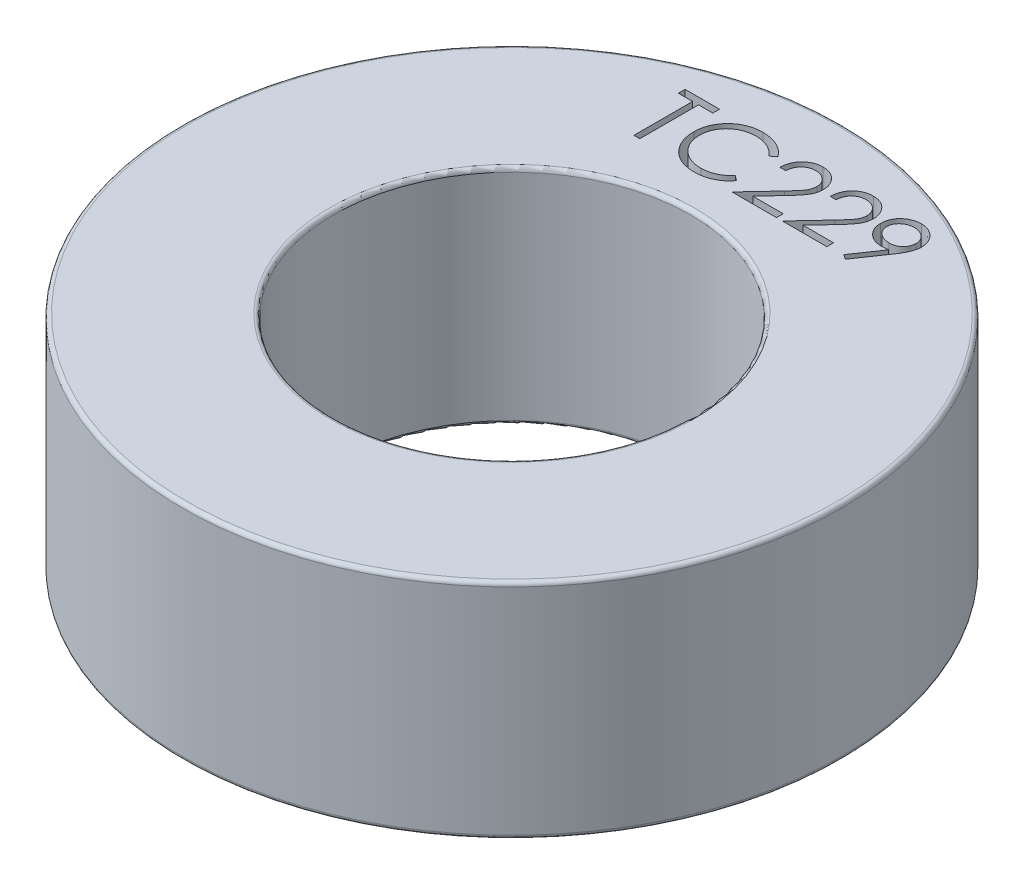
from build123d import *

# Parameters (mm, degrees)
CUT_EXTRUDE1_DEPTH = 1


with BuildPart() as part:
    # Toroidal Core TC229 → Revolve2 (revolve)
    with BuildSketch(Plane.XY, mode=Mode.PRIVATE) as revolve2_sk:
        with BuildLine():
            Line((6.646058459, 0), (11.853941541, 0))
            ThreePointArc((11.853941541, 0), (11.957220468, 0.042779532), (12, 0.146058459))
            Line((12, 0.146058459), (12, 7.973941541))
            ThreePointArc((12, 7.973941541), (11.957220468, 8.077220468), (11.853941541, 8.12))
            Line((11.853941541, 8.12), (6.646058459, 8.12))
            ThreePointArc((6.646058459, 8.12), (6.542779532, 8.077220468), (6.5, 7.973941541))
            Line((6.5, 7.973941541), (6.5, 0.146058459))
            ThreePointArc((6.5, 0.146058459), (6.542779532, 0.042779532), (6.646058459, 0))
        make_face()
    revolve(revolve2_sk.sketch.rotate(Axis((0, -8.107972275, 0), (0, 1, 0)), 90), axis=Axis((0, -8.107972275, 0), (0, 1, 0)))

    # Sketch1 → Cut-Extrude1 (cut)
    # profile 1 of 5: a face of its own
    with BuildSketch(Plane(origin=(0, 8.12, 0), x_dir=(1, 0, 0), z_dir=(0, 1, 0))):
        Polygon((-3.909128094, 9.970173817), (-3.909128094, 10.214404586), (-2.657445402, 10.214404586), (-2.657445402, 9.970173817), (-3.176435786, 9.970173817), (-3.176435786, 7.833154586), (-3.390137709, 7.833154586), (-3.390137709, 9.970173817), align=None)
    # profile 2 of 5: a face of its own
    with BuildSketch(Plane(origin=(0, 8.12, 0), x_dir=(1, 0, 0), z_dir=(0, 1, 0))):
        with BuildLine():
            Line((-0.093022325, 9.777460475), (-0.280011507, 9.634356509))
            add(Edge.make_bspline(
                [(-0.280011507, 9.634356509), (-0.293350514, 9.650253713), (-0.319848687, 9.681833793), (-0.362479323, 9.726179162), (-0.406907762, 9.767725349), (-0.453117022, 9.806670271), (-0.501938851, 9.841652034), (-0.552190573, 9.874493624), (-0.604712815, 9.903931139), (-0.67734212, 9.939624706), (-0.772352531, 9.976871644), (-0.891955805, 10.008102235), (-1.016808892, 10.027983071), (-1.101987973, 10.030136293), (-1.145313491, 10.031231509)],
                knots=[0, 0, 0, 0, 0.757959112, 1.505699292, 2.245454638, 2.979532153, 3.711538275, 4.438200793, 5.171680507, 5.909471876, 7.393775596, 8.890124382, 10.418191784, 12, 12, 12, 12], degree=3))
            add(Edge.make_bspline(
                [(-1.145313491, 10.031231509), (-1.169182664, 10.03095667), (-1.216699482, 10.030409543), (-1.287217461, 10.023191549), (-1.356418662, 10.013046601), (-1.424258071, 9.997993479), (-1.490649333, 9.978962108), (-1.556026485, 9.956220889), (-1.619442983, 9.928084828), (-1.681776106, 9.896986887), (-1.741497319, 9.861861786), (-1.798004414, 9.823548595), (-1.851091299, 9.782476049), (-1.900799969, 9.738490207), (-1.947181241, 9.691789159), (-1.989899037, 9.641875205), (-2.028805539, 9.588907923), (-2.064671943, 9.533585765), (-2.096793464, 9.476069875), (-2.1236879, 9.416147371), (-2.147503885, 9.354844401), (-2.166349262, 9.291468344), (-2.181265764, 9.226465141), (-2.191557978, 9.159660337), (-2.198693884, 9.091193494), (-2.19923829, 9.044786801), (-2.199512709, 9.02139452)],
                knots=[0, 0, 0, 0, 1.054917814, 2.100044995, 3.131103042, 4.146048494, 5.169673617, 6.183595914, 7.203665975, 8.234915748, 9.262203917, 10.264457458, 11.251630812, 12.227803204, 13.197192746, 14.159520551, 15.12972552, 16.100847026, 17.073214652, 18.039054194, 19.002613845, 19.979014051, 20.95965708, 21.949030935, 22.966165397, 24, 24, 24, 24], degree=3))
            add(Edge.make_bspline(
                [(-2.199512709, 9.02139452), (-2.198654222, 8.986198747), (-2.196968695, 8.917096515), (-2.181967954, 8.815879367), (-2.159172526, 8.718914409), (-2.125007999, 8.626807766), (-2.082880931, 8.538423687), (-2.029649372, 8.45525761), (-1.967997763, 8.376052769), (-1.897053917, 8.302681049), (-1.819217103, 8.235656532), (-1.735704685, 8.176635154), (-1.64672466, 8.127435207), (-1.553259489, 8.086494072), (-1.454589936, 8.055022977), (-1.350893437, 8.032867743), (-1.242395526, 8.018415474), (-1.168257416, 8.01703184), (-1.130526081, 8.016327663)],
                knots=[0, 0, 0, 0, 1.029171465, 2.020641659, 2.987623507, 3.938342917, 4.889210282, 5.84687017, 6.821220943, 7.821438502, 8.827599549, 9.822697543, 10.807740252, 11.797342354, 12.80366471, 13.83203677, 14.896651826, 16, 16, 16, 16], degree=3))
            add(Edge.make_bspline(
                [(-1.130526081, 8.016327663), (-1.08895443, 8.017476636), (-1.007131476, 8.01973809), (-0.88713823, 8.038896437), (-0.772269611, 8.069960127), (-0.66251944, 8.113433535), (-0.558197118, 8.169947597), (-0.45913939, 8.238458117), (-0.365262643, 8.319616787), (-0.308812539, 8.381585843), (-0.280011507, 8.413202663)],
                knots=[0, 0, 0, 0, 1.028121516, 2.023589091, 2.998037872, 3.967518031, 4.937445131, 5.927275754, 6.942489185, 8, 8, 8, 8], degree=3))
            Line((-0.280011507, 8.413202663), (-0.093022325, 8.271529736))
            add(Edge.make_bspline(
                [(-0.093022325, 8.271529736), (-0.108070539, 8.252113396), (-0.138094887, 8.21337372), (-0.186711859, 8.158760289), (-0.237927306, 8.107390579), (-0.292121637, 8.059678751), (-0.348671421, 8.014670088), (-0.408592047, 7.973643307), (-0.4710958, 7.936025758), (-0.535970901, 7.901581369), (-0.603148421, 7.871021599), (-0.672547867, 7.844859303), (-0.743870098, 7.822322548), (-0.817118374, 7.803781498), (-0.89244463, 7.789309564), (-0.969577042, 7.779635107), (-1.048682082, 7.773007126), (-1.102050263, 7.772403026), (-1.129095041, 7.772096893)],
                knots=[0, 0, 0, 0, 0.986787822, 1.968848986, 2.935600012, 3.899624008, 4.868462664, 5.837806735, 6.815139263, 7.798259679, 8.787526145, 9.778297419, 10.776456485, 11.791383307, 12.812564526, 13.85620153, 14.913611965, 16, 16, 16, 16], degree=3))
            add(Edge.make_bspline(
                [(-1.129095041, 7.772096893), (-1.154706179, 7.772275142), (-1.205349032, 7.772627606), (-1.280119433, 7.778337277), (-1.352910558, 7.786127188), (-1.423514366, 7.797856634), (-1.492316146, 7.811698051), (-1.558692186, 7.830252245), (-1.623295642, 7.851036589), (-1.68586696, 7.875464803), (-1.746459362, 7.903030277), (-1.80487742, 7.934184892), (-1.861094264, 7.96866666), (-1.915662595, 8.005715515), (-1.967776308, 8.046521501), (-2.01788701, 8.090517908), (-2.066275695, 8.137556447), (-2.096213236, 8.171475553), (-2.111265263, 8.188529436)],
                knots=[0, 0, 0, 0, 1.114604814, 2.203992996, 3.262667896, 4.300477797, 5.318619304, 6.316056647, 7.298880507, 8.271930387, 9.238335007, 10.195173496, 11.151986948, 12.108099108, 13.064862484, 14.031167946, 15.010108607, 16, 16, 16, 16], degree=3))
            add(Edge.make_bspline(
                [(-2.111265263, 8.188529436), (-2.135374157, 8.218152994), (-2.183300879, 8.277042471), (-2.244618532, 8.37248704), (-2.297106422, 8.472137732), (-2.339544325, 8.576518077), (-2.372720399, 8.685393852), (-2.395703676, 8.798819944), (-2.410638607, 8.916690418), (-2.4123465, 8.996861519), (-2.413214632, 9.037612969)],
                knots=[0, 0, 0, 0, 0.994628077, 1.977248131, 2.950237994, 3.925870899, 4.908910175, 5.911660606, 6.938484602, 8, 8, 8, 8], degree=3))
            add(Edge.make_bspline(
                [(-2.413214632, 9.037612969), (-2.412156545, 9.080445162), (-2.410074825, 9.164714826), (-2.3923884, 9.288386034), (-2.363936683, 9.406871182), (-2.323525586, 9.519949087), (-2.272291052, 9.62821451), (-2.208999731, 9.730840401), (-2.134386908, 9.828483081), (-2.049037759, 9.919660974), (-1.95544284, 10.003031498), (-1.855213432, 10.076378218), (-1.748545715, 10.137418171), (-1.636614819, 10.188442346), (-1.518582597, 10.227661168), (-1.394700876, 10.255115747), (-1.265202436, 10.272204357), (-1.176849607, 10.274364632), (-1.13195712, 10.275462278)],
                knots=[0, 0, 0, 0, 1.032925535, 2.032216505, 3.007276963, 3.968222605, 4.92396291, 5.891752235, 6.871517503, 7.883894988, 8.900124299, 9.891468569, 10.874487609, 11.85992873, 12.854644235, 13.869047385, 14.917252991, 16, 16, 16, 16], degree=3))
            add(Edge.make_bspline(
                [(-1.13195712, 10.275462278), (-1.104596917, 10.275134252), (-1.05044015, 10.274484957), (-0.970326292, 10.268153457), (-0.892328566, 10.257598664), (-0.816393237, 10.243232195), (-0.742150886, 10.225401857), (-0.670168936, 10.202174261), (-0.600025008, 10.175615478), (-0.532161487, 10.145027665), (-0.466903977, 10.110692257), (-0.404272803, 10.072989841), (-0.344765462, 10.031967159), (-0.287963227, 9.987973106), (-0.234816305, 9.940076943), (-0.183815728, 9.889596079), (-0.136693458, 9.835076459), (-0.107606017, 9.79670096), (-0.093022325, 9.777460475)],
                knots=[0, 0, 0, 0, 1.096760587, 2.17092713, 3.219439832, 4.250915756, 5.268269357, 6.278326846, 7.281116186, 8.274029601, 9.260640565, 10.235837813, 11.203064059, 12.156899882, 13.114053108, 14.069676657, 15.032185724, 16, 16, 16, 16], degree=3))
        make_face()
    # profile 3 of 5: a face of its own
    with BuildSketch(Plane(origin=(0, 8.12, 0), x_dir=(1, 0, 0), z_dir=(0, 1, 0))):
        with BuildLine():
            Line((0.487025752, 9.481712278), (0.273323829, 9.481712278))
            add(Edge.make_bspline(
                [(0.273323829, 9.481712278), (0.274716624, 9.510063364), (0.277452037, 9.565744143), (0.290261998, 9.646927015), (0.308591416, 9.724525012), (0.334507209, 9.797915078), (0.366692373, 9.867746124), (0.405289052, 9.933740778), (0.451004869, 9.995647283), (0.502852664, 10.052891746), (0.559164899, 10.105406861), (0.619924833, 10.150756231), (0.683772968, 10.189072361), (0.750515594, 10.221104421), (0.820905728, 10.245148137), (0.894304601, 10.262988217), (0.971034692, 10.273721766), (1.02331335, 10.274875506), (1.049901353, 10.275462278)],
                knots=[0, 0, 0, 0, 1.10065271, 2.161652631, 3.183658789, 4.190468796, 5.17591951, 6.163126047, 7.15150782, 8.156236427, 9.156009102, 10.134482811, 11.092018607, 12.041330605, 13.001268258, 13.972401359, 14.968799086, 16, 16, 16, 16], degree=3))
            add(Edge.make_bspline(
                [(1.049901353, 10.275462278), (1.07601215, 10.274851007), (1.127318933, 10.273649881), (1.202200411, 10.263334966), (1.273486391, 10.247179483), (1.341037533, 10.224513102), (1.404314873, 10.194043697), (1.463793766, 10.157442157), (1.520182317, 10.11511045), (1.570941575, 10.065271695), (1.617551537, 10.012066144), (1.657762178, 9.955264553), (1.692197205, 9.896597842), (1.720899895, 9.835618655), (1.742029161, 9.77175283), (1.758070763, 9.70593018), (1.767138164, 9.637469371), (1.768529782, 9.591132589), (1.769237291, 9.567574658)],
                knots=[0, 0, 0, 0, 1.111607364, 2.184268762, 3.212621178, 4.221274766, 5.211760367, 6.196651075, 7.1921475, 8.207485113, 9.220403448, 10.201281604, 11.166441695, 12.114753415, 13.065576456, 14.026450734, 14.996634279, 16, 16, 16, 16], degree=3))
            add(Edge.make_bspline(
                [(1.769237291, 9.567574658), (1.768085267, 9.53440872), (1.765801437, 9.468658861), (1.746265405, 9.372038035), (1.715753761, 9.278425369), (1.679016274, 9.203084455), (1.641955557, 9.14237381), (1.608558521, 9.092388852), (1.569461926, 9.038568881), (1.524096734, 8.981094121), (1.473401369, 8.91951438), (1.416916647, 8.853866859), (1.354239778, 8.784829815), (1.310248905, 8.737677255), (1.287453937, 8.713243979)],
                knots=[0, 0, 0, 0, 1.184426356, 2.348067706, 3.509069118, 4.696110526, 5.333549288, 6.050745305, 6.844228056, 7.710549037, 8.667450064, 9.695053472, 10.805634456, 12, 12, 12, 12], degree=3))
            Line((1.287453937, 8.713243979), (0.691664424, 8.077385355))
            Line((0.691664424, 8.077385355), (1.799766137, 8.077385355))
            Line((1.799766137, 8.077385355), (1.799766137, 7.833154586))
            Line((1.799766137, 7.833154586), (0.181737291, 7.833154586))
            Line((0.181737291, 7.833154586), (1.105234887, 8.818663901))
            add(Edge.make_bspline(
                [(1.105234887, 8.818663901), (1.127719253, 8.84213507), (1.170907118, 8.887218383), (1.231991335, 8.953038147), (1.286854647, 9.014099888), (1.335852195, 9.070288236), (1.377921062, 9.12242507), (1.415253777, 9.168821824), (1.44516608, 9.211517263), (1.477629591, 9.261006859), (1.509071603, 9.321430953), (1.536090188, 9.395272624), (1.552564933, 9.471287058), (1.554541259, 9.522655408), (1.555535368, 9.548494129)],
                knots=[0, 0, 0, 0, 1.329631726, 2.553950428, 3.673215718, 4.687767853, 5.603093632, 6.413772471, 7.123043292, 7.734684054, 8.834405432, 9.900288307, 10.943827018, 12, 12, 12, 12], degree=3))
            add(Edge.make_bspline(
                [(1.555535368, 9.548494129), (1.555102836, 9.564742009), (1.554250399, 9.59676346), (1.546727215, 9.643712021), (1.535358103, 9.688999868), (1.519066776, 9.732766304), (1.497562904, 9.774571292), (1.471387265, 9.81446572), (1.441186169, 9.853034463), (1.406248966, 9.889197689), (1.367868985, 9.922318295), (1.327323612, 9.951658074), (1.284427023, 9.976177541), (1.239360083, 9.99627767), (1.192248433, 10.012045206), (1.143000955, 10.022970775), (1.091753722, 10.029830465), (1.056760576, 10.030758589), (1.038930049, 10.031231509)],
                knots=[0, 0, 0, 0, 0.991446411, 1.95395049, 2.89581595, 3.838931463, 4.798493298, 5.75982156, 6.748411868, 7.785213223, 8.824556874, 9.840280684, 10.836137867, 11.835679398, 12.848801643, 13.863922112, 14.911575587, 16, 16, 16, 16], degree=3))
            add(Edge.make_bspline(
                [(1.038930049, 10.031231509), (1.020308107, 10.030745032), (0.983737689, 10.02978967), (0.930044561, 10.023106751), (0.878823345, 10.011577527), (0.829945193, 9.995809111), (0.783327403, 9.975766777), (0.739196688, 9.950803287), (0.697652115, 9.921014874), (0.658615587, 9.887241567), (0.622649201, 9.84963986), (0.591048738, 9.807723082), (0.563437114, 9.762256572), (0.539346189, 9.713363012), (0.51978205, 9.660598744), (0.50483246, 9.604151073), (0.493003195, 9.544265097), (0.489051326, 9.502909531), (0.487025752, 9.481712278)],
                knots=[0, 0, 0, 0, 1.031018746, 2.02475058, 2.990194455, 3.934040569, 4.864654155, 5.795059489, 6.735614925, 7.690564532, 8.649604399, 9.611025574, 10.590972636, 11.591080095, 12.624614302, 13.701020113, 14.821632451, 16, 16, 16, 16], degree=3))
        make_face()
    # profile 4 of 5: a face of its own
    with BuildSketch(Plane(origin=(0, 8.12, 0), x_dir=(1, 0, 0), z_dir=(0, 1, 0))):
        with BuildLine():
            Line((2.318756521, 9.481712278), (2.105054598, 9.481712278))
            add(Edge.make_bspline(
                [(2.105054598, 9.481712278), (2.106447393, 9.510063364), (2.109182806, 9.565744143), (2.121992767, 9.646927015), (2.140322185, 9.724525012), (2.166237978, 9.797915078), (2.198423142, 9.867746124), (2.237019822, 9.933740778), (2.282735638, 9.995647283), (2.334583434, 10.052891746), (2.390895668, 10.105406861), (2.451655602, 10.150756231), (2.515503737, 10.189072361), (2.582246364, 10.221104421), (2.652636497, 10.245148137), (2.72603537, 10.262988217), (2.802765461, 10.273721766), (2.855044119, 10.274875506), (2.881632122, 10.275462278)],
                knots=[0, 0, 0, 0, 1.10065271, 2.161652631, 3.183658789, 4.190468796, 5.17591951, 6.163126047, 7.15150782, 8.156236427, 9.156009102, 10.134482811, 11.092018607, 12.041330605, 13.001268258, 13.972401359, 14.968799086, 16, 16, 16, 16], degree=3))
            add(Edge.make_bspline(
                [(2.881632122, 10.275462278), (2.907742919, 10.274851007), (2.959049702, 10.273649881), (3.03393118, 10.263334966), (3.105217161, 10.247179483), (3.172768302, 10.224513102), (3.236045642, 10.194043697), (3.295524535, 10.157442157), (3.351913087, 10.11511045), (3.402672345, 10.065271695), (3.449282306, 10.012066144), (3.489492947, 9.955264553), (3.523927975, 9.896597842), (3.552630664, 9.835618655), (3.57375993, 9.77175283), (3.589801532, 9.70593018), (3.598868933, 9.637469371), (3.600260552, 9.591132589), (3.60096806, 9.567574658)],
                knots=[0, 0, 0, 0, 1.111607364, 2.184268762, 3.212621178, 4.221274766, 5.211760367, 6.196651075, 7.1921475, 8.207485113, 9.220403448, 10.201281604, 11.166441695, 12.114753415, 13.065576456, 14.026450734, 14.996634279, 16, 16, 16, 16], degree=3))
            add(Edge.make_bspline(
                [(3.60096806, 9.567574658), (3.599816036, 9.53440872), (3.597532206, 9.468658861), (3.577996175, 9.372038035), (3.54748453, 9.278425369), (3.510747043, 9.203084455), (3.473686327, 9.14237381), (3.44028929, 9.092388852), (3.401192696, 9.038568881), (3.355827503, 8.981094121), (3.305132138, 8.91951438), (3.248647417, 8.853866859), (3.185970548, 8.784829815), (3.141979675, 8.737677255), (3.119184706, 8.713243979)],
                knots=[0, 0, 0, 0, 1.184426356, 2.348067706, 3.509069118, 4.696110526, 5.333549288, 6.050745305, 6.844228056, 7.710549037, 8.667450064, 9.695053472, 10.805634456, 12, 12, 12, 12], degree=3))
            Line((3.119184706, 8.713243979), (2.523395193, 8.077385355))
            Line((2.523395193, 8.077385355), (3.631496906, 8.077385355))
            Line((3.631496906, 8.077385355), (3.631496906, 7.833154586))
            Line((3.631496906, 7.833154586), (2.01346806, 7.833154586))
            Line((2.01346806, 7.833154586), (2.936965656, 8.818663901))
            add(Edge.make_bspline(
                [(2.936965656, 8.818663901), (2.959450022, 8.84213507), (3.002637887, 8.887218383), (3.063722105, 8.953038147), (3.118585416, 9.014099888), (3.167582964, 9.070288236), (3.209651831, 9.12242507), (3.246984546, 9.168821824), (3.27689685, 9.211517263), (3.30936036, 9.261006859), (3.340802372, 9.321430953), (3.367820957, 9.395272624), (3.384295702, 9.471287058), (3.386272028, 9.522655408), (3.387266137, 9.548494129)],
                knots=[0, 0, 0, 0, 1.329631726, 2.553950428, 3.673215718, 4.687767853, 5.603093632, 6.413772471, 7.123043292, 7.734684054, 8.834405432, 9.900288307, 10.943827018, 12, 12, 12, 12], degree=3))
            add(Edge.make_bspline(
                [(3.387266137, 9.548494129), (3.386833605, 9.564742009), (3.385981168, 9.59676346), (3.378457984, 9.643712021), (3.367088872, 9.688999868), (3.350797545, 9.732766304), (3.329293673, 9.774571292), (3.303118035, 9.81446572), (3.272916938, 9.853034463), (3.237979735, 9.889197689), (3.199599755, 9.922318295), (3.159054381, 9.951658074), (3.116157792, 9.976177541), (3.071090852, 9.99627767), (3.023979202, 10.012045206), (2.974731724, 10.022970775), (2.923484492, 10.029830465), (2.888491345, 10.030758589), (2.870660818, 10.031231509)],
                knots=[0, 0, 0, 0, 0.991446411, 1.95395049, 2.89581595, 3.838931463, 4.798493298, 5.75982156, 6.748411868, 7.785213223, 8.824556874, 9.840280684, 10.836137867, 11.835679398, 12.848801643, 13.863922112, 14.911575587, 16, 16, 16, 16], degree=3))
            add(Edge.make_bspline(
                [(2.870660818, 10.031231509), (2.852038877, 10.030745032), (2.815468458, 10.02978967), (2.76177533, 10.023106751), (2.710554114, 10.011577527), (2.661675962, 9.995809111), (2.615058172, 9.975766777), (2.570927457, 9.950803287), (2.529382884, 9.921014874), (2.490346356, 9.887241567), (2.454379971, 9.84963986), (2.422779507, 9.807723082), (2.395167883, 9.762256572), (2.371076958, 9.713363012), (2.351512819, 9.660598744), (2.336563229, 9.604151073), (2.324733964, 9.544265097), (2.320782095, 9.502909531), (2.318756521, 9.481712278)],
                knots=[0, 0, 0, 0, 1.031018746, 2.02475058, 2.990194455, 3.934040569, 4.864654155, 5.795059489, 6.735614925, 7.690564532, 8.649604399, 9.611025574, 10.590972636, 11.591080095, 12.624614302, 13.701020113, 14.821632451, 16, 16, 16, 16], degree=3))
        make_face()
    # profile 5 of 5: a face of its own
    with BuildSketch(Plane(origin=(0, 8.12, 0), x_dir=(1, 0, 0), z_dir=(0, 1, 0))):
        with BuildLine():
            Line((4.364189214, 7.772096893), (4.193418481, 7.890873186))
            Line((4.193418481, 7.890873186), (4.855512831, 8.858733011))
            add(Edge.make_bspline(
                [(4.855512831, 8.858733011), (4.813268956, 8.853567016), (4.73008841, 8.843394884), (4.646311203, 8.841526178), (4.60508089, 8.840606509)],
                knots=[0, 0, 0, 0, 1.015715272, 2, 2, 2, 2], degree=3))
            add(Edge.make_bspline(
                [(4.60508089, 8.840606509), (4.580083176, 8.841246777), (4.531014848, 8.842503567), (4.458875456, 8.852465226), (4.389556887, 8.867807367), (4.323242914, 8.890700537), (4.259684287, 8.919151855), (4.199019757, 8.954433144), (4.141330988, 8.995939211), (4.087237554, 9.043450585), (4.038039746, 9.095619046), (3.994208895, 9.150833867), (3.957781804, 9.209736447), (3.927521841, 9.271125222), (3.904573086, 9.335882533), (3.887861788, 9.4032715), (3.877573186, 9.473764421), (3.876349159, 9.521746698), (3.875727675, 9.546109063)],
                knots=[0, 0, 0, 0, 1.060718605, 2.082097864, 3.085795603, 4.069760067, 5.054557537, 6.03741023, 7.043284206, 8.066802108, 9.088538119, 10.083643548, 11.053783639, 12.022749082, 12.983451788, 13.964007469, 14.966251758, 16, 16, 16, 16], degree=3))
            add(Edge.make_bspline(
                [(3.875727675, 9.546109063), (3.87690771, 9.579425236), (3.87922388, 9.644818124), (3.897864657, 9.740363242), (3.92852178, 9.830705515), (3.971267515, 9.915607415), (4.025107388, 9.993847629), (4.089815197, 10.064338486), (4.164997358, 10.126077395), (4.248941196, 10.179148027), (4.339668877, 10.22183023), (4.434693446, 10.253289469), (4.533286802, 10.271794331), (4.600075878, 10.274233997), (4.633701684, 10.275462278)],
                knots=[0, 0, 0, 0, 1.022988612, 2.007919123, 2.978103895, 3.94594894, 4.918897164, 5.887013414, 6.875921846, 7.89917871, 8.930658928, 9.948724884, 10.967259574, 12, 12, 12, 12], degree=3))
            add(Edge.make_bspline(
                [(4.633701684, 10.275462278), (4.666691126, 10.274217114), (4.731875155, 10.271756786), (4.827729997, 10.253738228), (4.919538082, 10.223369349), (5.006790475, 10.181401816), (5.087575682, 10.128795984), (5.160221368, 10.066111602), (5.223069726, 9.993309628), (5.276017759, 9.912150851), (5.318519697, 9.82495153), (5.349184947, 9.733930683), (5.36806189, 9.63974291), (5.370440642, 9.57592917), (5.371641137, 9.543723997)],
                knots=[0, 0, 0, 0, 1.026385292, 2.028040595, 3.023318987, 4.028184125, 5.03290303, 6.015178782, 7.004435299, 8.016004309, 9.023023918, 10.015172535, 10.998308025, 12, 12, 12, 12], degree=3))
            add(Edge.make_bspline(
                [(5.371641137, 9.543723997), (5.370839398, 9.518725112), (5.369213271, 9.468021128), (5.357826605, 9.390984056), (5.338490729, 9.312435987), (5.316548055, 9.245950402), (5.295367063, 9.191039831), (5.275431828, 9.147665989), (5.253311953, 9.102013165), (5.22751365, 9.054560065), (5.19978073, 9.004701769), (5.168443972, 8.95293835), (5.134218217, 8.899200346), (5.109841211, 8.862973309), (5.097358535, 8.844422615)],
                knots=[0, 0, 0, 0, 1.179839688, 2.393009684, 3.667231171, 4.993948276, 5.694988576, 6.444077775, 7.246288328, 8.089075292, 8.993003841, 9.939041771, 10.944649915, 12, 12, 12, 12], degree=3))
            Line((5.097358535, 8.844422615), (4.364189214, 7.772096893))
        make_face()
        with BuildLine():
            add(Edge.make_bspline(
                [(4.644672988, 9.084837278), (4.663610058, 9.085354611), (4.700474096, 9.086361681), (4.754479009, 9.092491183), (4.805454225, 9.103359199), (4.853535915, 9.118952789), (4.899206182, 9.137769201), (4.941739612, 9.161725927), (4.981171803, 9.190312245), (5.017766803, 9.222431916), (5.050263382, 9.258117045), (5.079207836, 9.295466684), (5.103809937, 9.334644785), (5.123243166, 9.376141986), (5.139221065, 9.418948158), (5.150255105, 9.463752639), (5.156367661, 9.510321998), (5.157409679, 9.541957692), (5.157939214, 9.558034393)],
                knots=[0, 0, 0, 0, 1.163407946, 2.26475976, 3.333800367, 4.359385343, 5.366239384, 6.363380779, 7.350133999, 8.353570782, 9.349036268, 10.310270964, 11.253520213, 12.184142, 13.120487599, 14.056272588, 15.012232024, 16, 16, 16, 16], degree=3))
            add(Edge.make_bspline(
                [(5.157939214, 9.558034393), (5.157483599, 9.574117809), (5.156585756, 9.605812151), (5.149382611, 9.652450456), (5.136710807, 9.697145335), (5.119708352, 9.740141478), (5.097310834, 9.781085624), (5.070434355, 9.820491822), (5.038503527, 9.858110216), (5.001762496, 9.893056069), (4.962142202, 9.925269551), (4.919918897, 9.953699006), (4.875440606, 9.977525927), (4.828978683, 9.997187548), (4.780436325, 10.012530809), (4.729842254, 10.023564409), (4.676940808, 10.029668406), (4.641030683, 10.030703838), (4.62273038, 10.031231509)],
                knots=[0, 0, 0, 0, 0.972161553, 1.915763587, 2.844109794, 3.775983486, 4.705125789, 5.659731448, 6.655561913, 7.682237399, 8.721216875, 9.739758359, 10.754845918, 11.767244016, 12.7857855, 13.828538656, 14.893392813, 16, 16, 16, 16], degree=3))
            add(Edge.make_bspline(
                [(4.62273038, 10.031231509), (4.604589232, 10.030702986), (4.568996451, 10.029666028), (4.5165653, 10.023576012), (4.466313327, 10.012456606), (4.417911617, 9.997194655), (4.371451075, 9.97752446), (4.326974882, 9.953697757), (4.284741701, 9.925276095), (4.245159392, 9.893030723), (4.208353485, 9.858272878), (4.176971652, 9.820327027), (4.150033664, 9.781106122), (4.127666921, 9.74013603), (4.11065628, 9.697146789), (4.097986668, 9.652450062), (4.090782934, 9.605812253), (4.089885172, 9.574117843), (4.089429598, 9.558034393)],
                knots=[0, 0, 0, 0, 1.099389452, 2.15699305, 3.192601482, 4.213358962, 5.227959689, 6.245255729, 7.266013209, 8.307253147, 9.336162325, 10.327954924, 11.284637477, 12.215801273, 13.149702402, 14.080068371, 15.025723358, 16, 16, 16, 16], degree=3))
            add(Edge.make_bspline(
                [(4.089429598, 9.558034393), (4.089841844, 9.541945173), (4.090654869, 9.510214284), (4.098497883, 9.463591863), (4.111613999, 9.418900431), (4.129180406, 9.375705436), (4.15231363, 9.334426904), (4.180700748, 9.295260538), (4.213973986, 9.257762348), (4.251688555, 9.222514941), (4.292964572, 9.190162479), (4.337049501, 9.161906987), (4.383184408, 9.138045199), (4.431531696, 9.118899007), (4.481733072, 9.103515), (4.534239724, 9.092511213), (4.588878007, 9.086420475), (4.625896227, 9.085370073), (4.644672988, 9.084837278)],
                knots=[0, 0, 0, 0, 0.952633368, 1.87876736, 2.791047057, 3.707742249, 4.635551637, 5.587206343, 6.568248508, 7.601284464, 8.641511608, 9.671105535, 10.699146789, 11.713763218, 12.747829548, 13.806491675, 14.887386225, 16, 16, 16, 16], degree=3))
        make_face(mode=Mode.SUBTRACT)
    extrude(amount=-CUT_EXTRUDE1_DEPTH, mode=Mode.SUBTRACT)


solid = part.part
